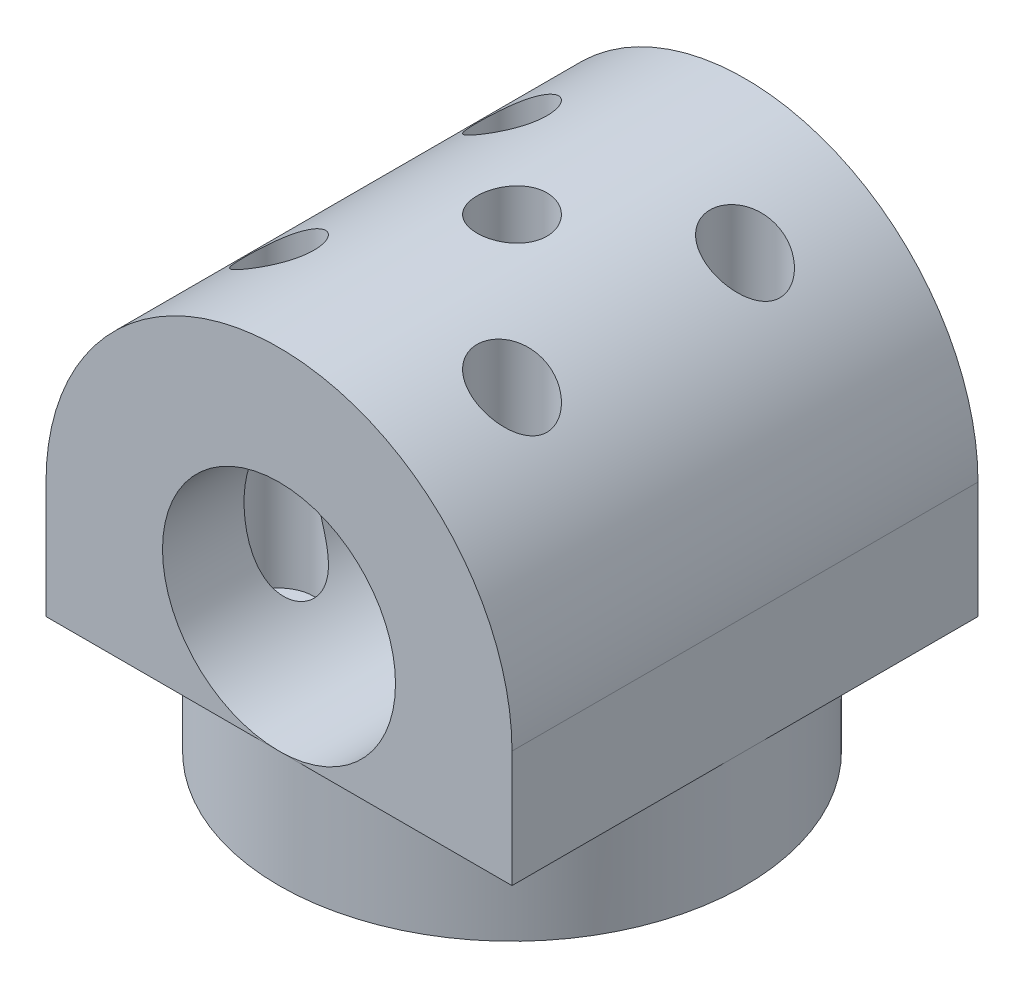
from build123d import *
from build123d.topology import SkipClean

# Parameters (mm, degrees)
SKIZZE1_R                       = 20
AUFSATZ_LINEAR_AUSTRAGEN1_DEPTH = 10
AUFSATZ_LINEAR_AUSTRAGEN2_DEPTH = 20
SKIZZE3_R                       = 10
SCHNITT_LINEAR_AUSTRAGEN1_DEPTH = 61
SKIZZE4_R                       = 1.575
SCHNITT_LINEAR_AUSTRAGEN2_DEPTH = 49.989794856
SKIZZE5_R                       = 3
SCHNITT_LINEAR_AUSTRAGEN3_DEPTH = 42.231056444
SCHNITT_LINEAR_START            = -3
SKIZZE6_R                       = 3
SCHNITT_LINEAR_AUSTRAGEN4_DEPTH = 3


with BuildPart() as part:
    # Skizze1 → Aufsatz-Linear austragen1 (new body)
    with BuildSketch(Plane(origin=(0, 0, 0), x_dir=(1, 0, 0), z_dir=(0, 1, 0))):
        with Locations(Location((0, 0, 0), (0, 0, 270))):
            Circle(SKIZZE1_R)
    extrude(amount=AUFSATZ_LINEAR_AUSTRAGEN1_DEPTH)

    # Skizze2 → Aufsatz-Linear austragen2 (add, symmetric)
    with BuildSketch(Plane.XY):
        with BuildLine():
            Line((20, 20), (20, 10))
            Line((20, 10), (-20, 10))
            Line((-20, 10), (-20, 20))
            ThreePointArc((-20, 20), (0, 40), (20, 20))
        make_face()
    extrude(amount=AUFSATZ_LINEAR_AUSTRAGEN2_DEPTH, both=True)

    # Skizze3 → Schnitt-Linear austragen1 (cut, through all)
    with BuildSketch(Plane.XY.offset(20)):
        with Locations(Location((0, 20, 0), (0, 0, 270))):
            Circle(SKIZZE3_R)
    extrude(amount=-SCHNITT_LINEAR_AUSTRAGEN1_DEPTH, mode=Mode.SUBTRACT)

    # Skizze4 → Schnitt-Linear austragen2 (cut, through all)
    with BuildSketch(Plane.XZ):
        with Locations(Location((-10, 10, 0), (0, 0, 270))):
            Circle(SKIZZE4_R)
        with Locations(Location((-10, -10, 0), (0, 0, 270))):
            Circle(SKIZZE4_R)
        with Locations(Location((10, -10, 0), (0, 0, 270))):
            Circle(SKIZZE4_R)
        with Locations(Location((10, 10, 0), (0, 0, 270))):
            Circle(SKIZZE4_R)
        with Locations(Location((0, 0, 0), (0, 0, 270))):
            Circle(SKIZZE4_R)
    extrude(amount=-SCHNITT_LINEAR_AUSTRAGEN2_DEPTH, mode=Mode.SUBTRACT)

    # Skizze5 → Schnitt-Linear austragen3 (cut, through all)
    with BuildSketch(Plane(origin=(0, 10, 0), x_dir=(1, 0, 0), z_dir=(0, 1, 0))):
        with Locations(Location((-10, 10, 0), (0, 0, 90))):
            Circle(SKIZZE5_R)
        with Locations(Location((-10, -10, 0), (0, 0, 90))):
            Circle(SKIZZE5_R)
        with Locations(Location((0, 0, 0), (0, 0, 90))):
            Circle(SKIZZE5_R)
        with Locations(Location((10, -10, 0), (0, 0, 90))):
            Circle(SKIZZE5_R)
        with Locations(Location((10, 10, 0), (0, 0, 90))):
            Circle(SKIZZE5_R)
    extrude(amount=SCHNITT_LINEAR_AUSTRAGEN3_DEPTH, mode=Mode.SUBTRACT)

    # Skizze6 → Schnitt-Linear austragen4 (cut)
    with SkipClean():  # the faces are left unmerged after this step: merging them gives an invalid solid
        with BuildSketch(Plane(origin=(0, 10, 0), x_dir=(1, 0, 0), z_dir=(0, 1, 0)).offset(SCHNITT_LINEAR_START)):
            with Locations(Location((0, 0, 0), (0, 0, 270.000000001))):
                Circle(SKIZZE6_R)
        extrude(amount=SCHNITT_LINEAR_AUSTRAGEN4_DEPTH, mode=Mode.SUBTRACT)


solid = part.part
